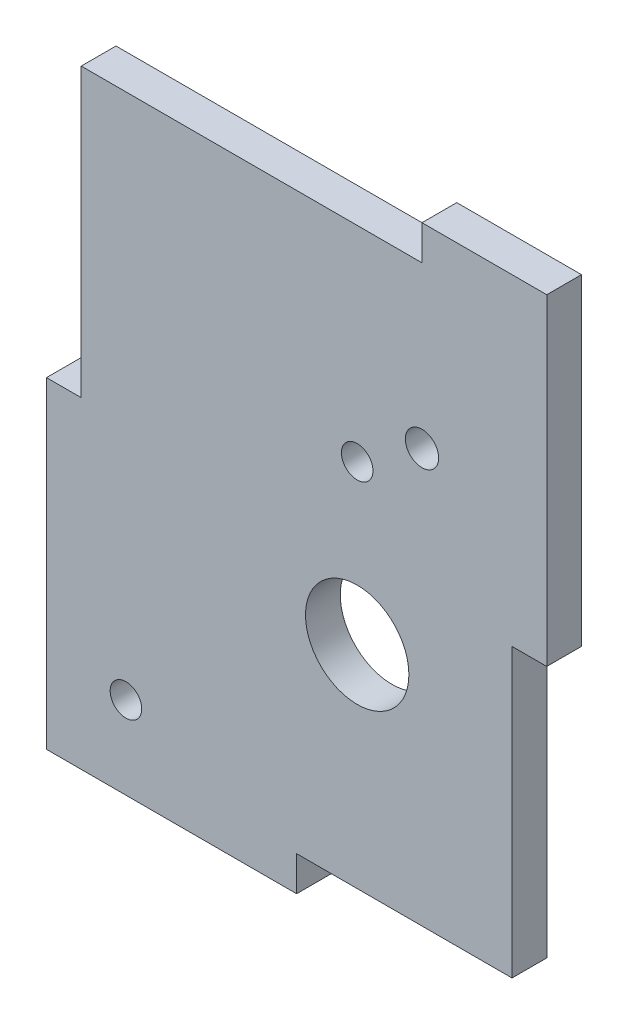
from build123d import *

# Parameters (mm, degrees)
BACKSKETCH_W        = 38.1
BACKSKETCH_H        = 50.8
BACKSKETCH_R        = 1.4732
BACKSKETCH_R_2      = 4.572
BACKSKETCH_R_3      = 1.397
BOSS_EXTRUDE1_DEPTH = 3.0734


with BuildPart() as part:
    # backSketch → Boss-Extrude1 (new body)
    # profile 1 of 3: a face of its own
    with BuildSketch(Plane.XY):
        Polygon((38.1, 50.8), (38.1, 25.4), (41.1734, 25.4), (41.1734, 53.8734), (30.138343409, 53.8734), (30.138343409, 50.8), align=None)
    # profile 2 of 3: a face of its own
    with BuildSketch(Plane.XY):
        Polygon((19.05, 0), (0, 0), (0, 25.4), (-3.0734, 25.4), (-3.0734, -3.0734), (19.05, -3.0734), align=None)
    # profile 3 of 3: a face of its own
    with BuildSketch(Plane.XY):
        with Locations((19.05, 25.4)):
            Rectangle(BACKSKETCH_W, BACKSKETCH_H)
        with Locations((30.138343409, 36.578509469)):
            Circle(BACKSKETCH_R, mode=Mode.SUBTRACT)
        with Locations((24.406777228, 18.677705992)):
            Circle(BACKSKETCH_R_2, mode=Mode.SUBTRACT)
        with Locations((24.406777228, 32.695044925)):
            Circle(BACKSKETCH_R_3, mode=Mode.SUBTRACT)
        with Locations((3.953040425, 4.229498122)):
            Circle(BACKSKETCH_R_3, mode=Mode.SUBTRACT)
    extrude(amount=BOSS_EXTRUDE1_DEPTH)


solid = part.part
